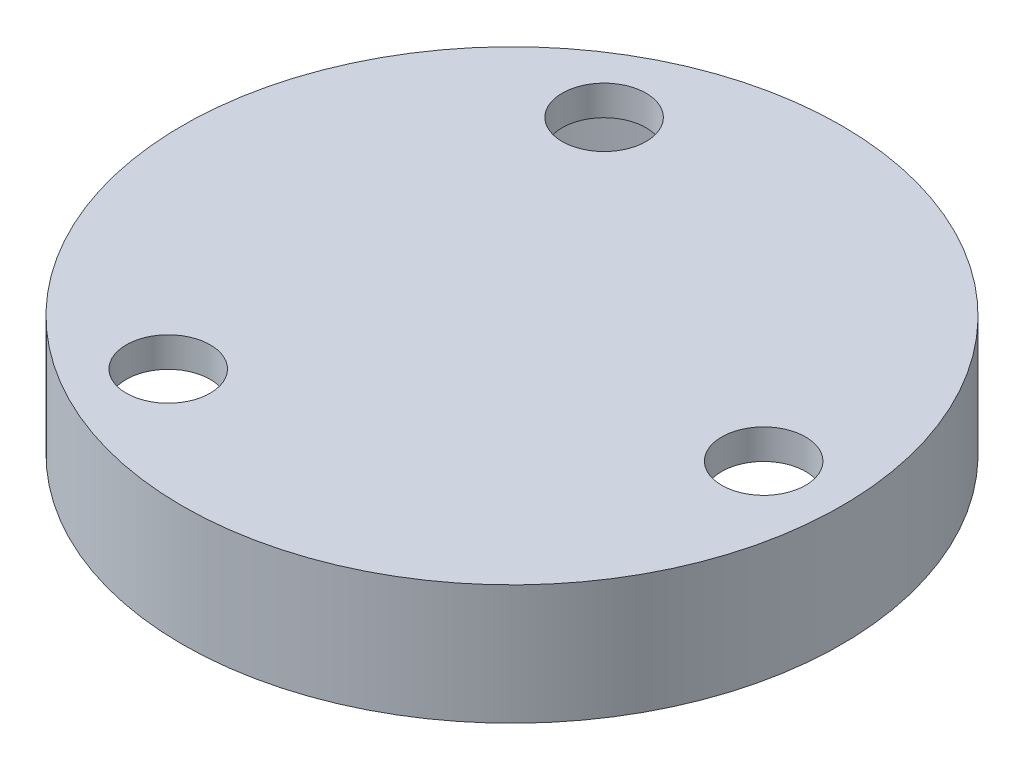
from build123d import *

# Parameters (mm, degrees)
SKETCH1_R               = 55
BOSS_EXTRUDE1_DEPTH     = 10
SHELL1_T                = -5
CUT_EXTRUDE3_DEPTH      = 79.421935707
CUT_EXTRUDE3_DEPTH_BACK = 79.421935707
SKETCH1_4_R             = 7


with BuildPart() as part:
    # Sketch1 → Boss-Extrude1 (new, symmetric)
    with BuildSketch(Plane(origin=(0, 0, 0), x_dir=(1, 0, 0), z_dir=(0, 1, 0))):
        Circle(SKETCH1_R)
    extrude(amount=BOSS_EXTRUDE1_DEPTH, both=True)

    # Shell1
    shell1_openings = [part.faces().sort_by_distance(p)[0] for p in [
        (0, -10, 0),
    ]]
    offset(amount=SHELL1_T, openings=shell1_openings, kind=Kind.INTERSECTION)

    # Sketch1<4> → Cut-Extrude3 (cut, two sides: drawn at the far end of the back side and taken through both)
    with BuildSketch(Plane(origin=(0, 0, 0), x_dir=(1, 0, 0), z_dir=(0, 1, 0)).offset(-CUT_EXTRUDE3_DEPTH_BACK)):
        with Locations((42, 0)):
            Circle(SKETCH1_4_R)
        with Locations((-21, -36.373066959)):
            Circle(SKETCH1_4_R)
        with Locations((-21, 36.373066959)):
            Circle(SKETCH1_4_R)
    extrude(amount=CUT_EXTRUDE3_DEPTH + CUT_EXTRUDE3_DEPTH_BACK, mode=Mode.SUBTRACT)


solid = part.part
